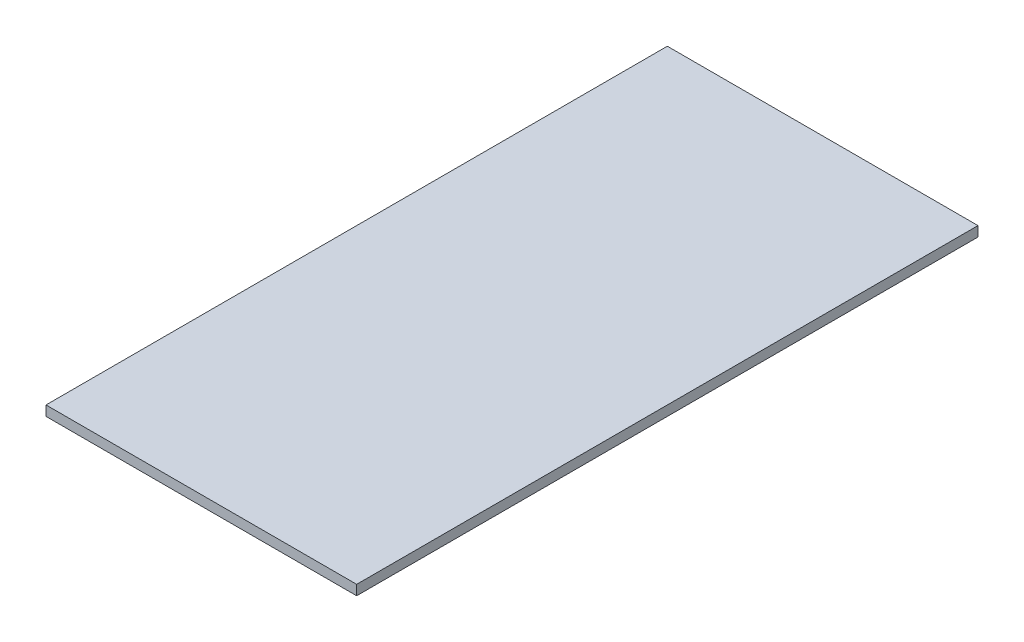
from build123d import *

# Parameters (mm, degrees)
SKETCH_1_W      = 50
SKETCH_1_H      = 100
EXTRUDE_1_DEPTH = 1.6


with BuildPart() as part:
    # 草图1 → 凸台-拉伸1 (new body)
    with BuildSketch(Plane(origin=(0, 0, 0), x_dir=(1, 0, 0), z_dir=(0, 1, 0))):
        with Locations((25, 50)):
            Rectangle(SKETCH_1_W, SKETCH_1_H)
    extrude(amount=EXTRUDE_1_DEPTH)


solid = part.part
